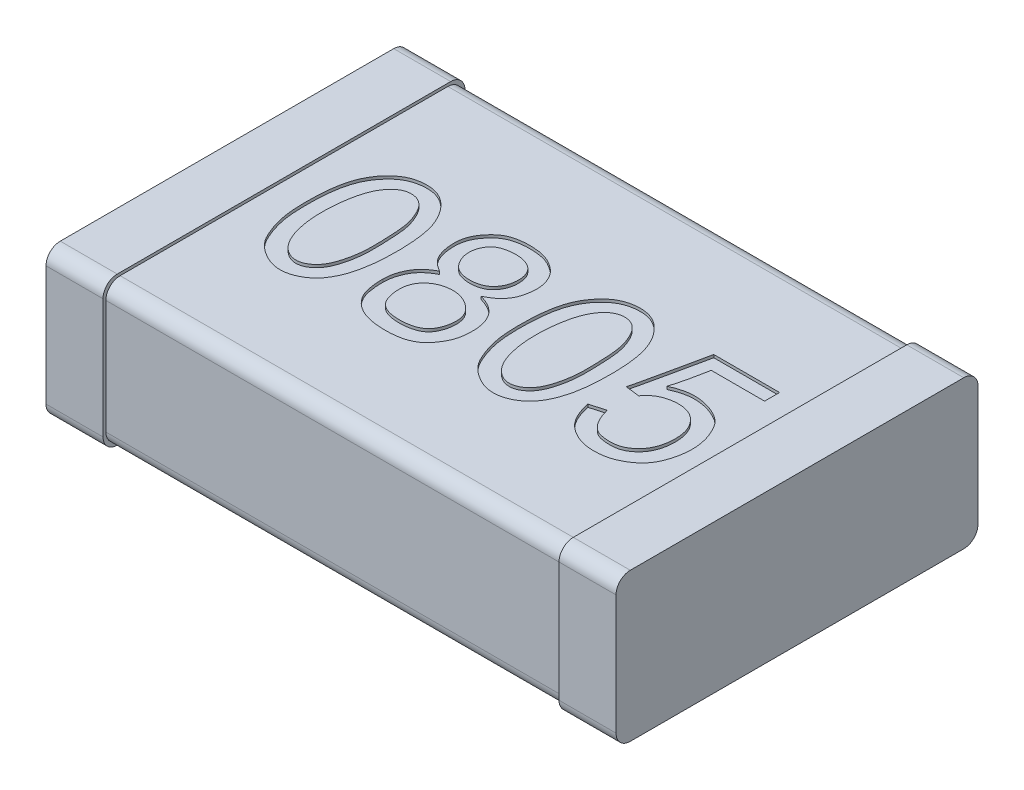
from build123d import *

# Parameters (mm, degrees)
SKETCH_1_W          = 2
SKETCH_1_H          = 1.25
EXTRUDE_1_DEPTH     = 0.5
SKETCH_2_W          = 1.27
SKETCH_2_H          = 0.52
EXTRUDE_2_DEPTH     = 0.2
SKETCH_3_W          = 1.27
SKETCH_3_H          = 0.52
EXTRUDE_3_DEPTH     = 0.2
CUT_EXTRUDE_1_DEPTH = 0.01
FILLET_1_R          = 0.05
FILLET_2_R          = 0.05


with BuildPart() as part:
    # 草图1 → 凸台-拉伸1 (new body)
    with BuildSketch(Plane(origin=(0, 0, 0), x_dir=(1, 0, 0), z_dir=(0, 1, 0))):
        Rectangle(SKETCH_1_W, SKETCH_1_H)
    extrude(amount=EXTRUDE_1_DEPTH)

    # 草图2 → 凸台-拉伸2 (add)
    with BuildSketch(Plane.ZY.offset(1)):
        with Locations((0, 0.25)):
            Rectangle(SKETCH_2_W, SKETCH_2_H)
    extrude(amount=-EXTRUDE_2_DEPTH)

    # 草图3 → 凸台-拉伸3 (add)
    with BuildSketch(Plane(origin=(1, 0, 0), x_dir=(0, 0, -1), z_dir=(1, 0, 0))):
        with Locations((0, 0.25)):
            Rectangle(SKETCH_3_W, SKETCH_3_H)
    extrude(amount=-EXTRUDE_3_DEPTH)

    # 草图4 → 切除-拉伸1 (cut)
    # profile 1 of 4: a face of its own
    with BuildSketch(Plane(origin=(0, 0.5, 0), x_dir=(1, 0, 0), z_dir=(0, 1, 0))):
        with BuildLine():
            add(Edge.make_bspline(
                [(-0.697551724, 0.012086435), (-0.697273285, 0.018370502), (-0.696730214, 0.030627027), (-0.695161169, 0.048498422), (-0.693266387, 0.065412192), (-0.69080292, 0.081316611), (-0.6877582, 0.09615874), (-0.68431195, 0.110016365), (-0.680329265, 0.122850712), (-0.674464846, 0.138525208), (-0.66567087, 0.156566364), (-0.653092049, 0.176394886), (-0.638475041, 0.194219333), (-0.624646887, 0.207279888), (-0.612656941, 0.216471968), (-0.603077204, 0.222440088), (-0.593012784, 0.227539397), (-0.582430676, 0.231697991), (-0.57135034, 0.234795743), (-0.559801131, 0.23708278), (-0.547744932, 0.238497576), (-0.535321613, 0.238918496), (-0.522804682, 0.238329132), (-0.510508589, 0.236409151), (-0.498643075, 0.233000694), (-0.487200036, 0.228321421), (-0.476210616, 0.222309135), (-0.465619495, 0.21501213), (-0.455552235, 0.206241697), (-0.445883363, 0.196353957), (-0.436852354, 0.185471712), (-0.428579969, 0.173804982), (-0.421100573, 0.161474107), (-0.41451386, 0.148411439), (-0.408609653, 0.134732164), (-0.403656549, 0.120314435), (-0.399558709, 0.105216828), (-0.395046346, 0.08388881), (-0.391076445, 0.055597746), (-0.388279599, 0.019792076), (-0.387641402, -0.018386797), (-0.388591689, -0.051403705), (-0.390383002, -0.078155018), (-0.392419526, -0.097558078), (-0.395154932, -0.115972347), (-0.398339269, -0.133487456), (-0.402323068, -0.15001026), (-0.407043913, -0.165558463), (-0.412144574, -0.180233637), (-0.418148327, -0.193881523), (-0.424687356, -0.206618025), (-0.432142408, -0.218279995), (-0.440218917, -0.229024955), (-0.44913098, -0.238767754), (-0.458994708, -0.247312134), (-0.469466928, -0.255070392), (-0.480828878, -0.261673544), (-0.492777795, -0.267276961), (-0.50508428, -0.271736567), (-0.517594692, -0.274643206), (-0.53007303, -0.276370796), (-0.542607227, -0.276377116), (-0.55512302, -0.275287325), (-0.56756901, -0.272420568), (-0.580098714, -0.268479087), (-0.59237652, -0.262905087), (-0.604193618, -0.256486906), (-0.615316658, -0.249579015), (-0.625441662, -0.242062239), (-0.63464953, -0.234034941), (-0.643055126, -0.22556452), (-0.650559253, -0.216570563), (-0.657084022, -0.207028167), (-0.664375332, -0.193598514), (-0.672186654, -0.176275889), (-0.680271328, -0.154938575), (-0.68687896, -0.133088019), (-0.691127802, -0.114310704), (-0.693929058, -0.098602045), (-0.695470314, -0.085724854), (-0.696809127, -0.071863065), (-0.697618267, -0.057013447), (-0.698156481, -0.041163126), (-0.698390721, -0.02430081), (-0.698140008, -0.006428462), (-0.697751281, 0.005805843), (-0.697551724, 0.012086435)],
                knots=[0, 0, 0, 0, 1.18043416, 2.302333746, 3.366253517, 4.374302266, 5.321670991, 6.208995316, 7.053297808, 7.84229274, 9.348259463, 10.810477328, 12.240076564, 13.663562249, 14.3695339, 15.072606272, 15.778577923, 16.484387009, 17.202829605, 17.934942377, 18.692112664, 19.478485278, 20.265441384, 21.040673806, 21.808439453, 22.577161074, 23.356320991, 24.155029842, 24.986154494, 25.858111265, 26.748121484, 27.637306138, 28.540117759, 29.452135788, 30.380885827, 31.334339875, 32.310628684, 33.31521083, 35.42407972, 37.666773946, 40.052062172, 42.587025658, 43.863776122, 45.083322308, 46.247467896, 47.357025429, 48.423487632, 49.435172604, 50.405897663, 51.337337341, 52.231284254, 53.090220275, 53.931690991, 54.751583713, 55.562922169, 56.377338113, 57.194202079, 58.024663732, 58.851830165, 59.645552351, 60.431282623, 61.21044254, 61.99312915, 62.783838437, 63.60230231, 64.454612977, 65.309477934, 66.125301685, 66.909862715, 67.67340185, 68.415973016, 69.147238889, 69.868837108, 70.581506411, 72.0124375, 73.431838244, 74.861437481, 76.292961888, 77.042577341, 77.855187732, 78.726196438, 79.655959089, 80.645695907, 81.702690171, 82.820655125, 84, 84, 84, 84], degree=3))
        make_face()
        with BuildLine():
            add(Edge.make_bspline(
                [(-0.636148216, 0.029630295), (-0.636812051, 0.023028505), (-0.638119831, 0.01002275), (-0.639189436, -0.009271034), (-0.639494245, -0.028018652), (-0.639215123, -0.046227686), (-0.638138697, -0.063862507), (-0.636302132, -0.080957243), (-0.633686, -0.097499894), (-0.630484086, -0.113446593), (-0.626647751, -0.12854246), (-0.622098166, -0.142582398), (-0.616919643, -0.155464127), (-0.61119098, -0.167207052), (-0.604902659, -0.177825192), (-0.597937584, -0.187258251), (-0.590491167, -0.195706903), (-0.582340871, -0.202806994), (-0.573981557, -0.208769539), (-0.565435089, -0.21340238), (-0.556840855, -0.216685213), (-0.548166053, -0.21869248), (-0.539441951, -0.219333388), (-0.530665069, -0.218712576), (-0.521900332, -0.216545779), (-0.513191274, -0.21322486), (-0.504787762, -0.208650908), (-0.496837745, -0.203127839), (-0.489506984, -0.196532112), (-0.482791604, -0.188934524), (-0.476730003, -0.180288081), (-0.471183747, -0.1707406), (-0.466313713, -0.160133725), (-0.460586972, -0.144603367), (-0.454819597, -0.123921092), (-0.44968852, -0.098076822), (-0.446662085, -0.071124618), (-0.445868586, -0.043471665), (-0.446384518, -0.015995037), (-0.447003315, 0.01062221), (-0.448491233, 0.035930332), (-0.450271976, 0.0600582), (-0.453294063, 0.083113537), (-0.458863368, 0.104975587), (-0.466664328, 0.12570363), (-0.474671168, 0.142066309), (-0.482344699, 0.153943772), (-0.488393923, 0.161913208), (-0.495119117, 0.168572627), (-0.502210444, 0.174249821), (-0.509832864, 0.178571987), (-0.517917445, 0.181805069), (-0.526460656, 0.183808636), (-0.535333027, 0.184796557), (-0.544271637, 0.184623855), (-0.55305151, 0.183054961), (-0.561567097, 0.180311184), (-0.569871981, 0.176405083), (-0.577791916, 0.171118283), (-0.5854535, 0.164647733), (-0.592770418, 0.156884475), (-0.599978053, 0.148039205), (-0.606552671, 0.13776812), (-0.612633031, 0.126262575), (-0.618025178, 0.113374741), (-0.622854403, 0.099179209), (-0.627191513, 0.083676749), (-0.63083815, 0.066858036), (-0.633864215, 0.048709664), (-0.635369528, 0.036135052), (-0.636148216, 0.029630295)],
                knots=[0, 0, 0, 0, 1.378198314, 2.715098627, 4.012594964, 5.272602849, 6.497213731, 7.681415101, 8.842769074, 9.975170128, 11.059162755, 12.076494648, 13.038717388, 13.940857576, 14.788360499, 15.598271168, 16.373595835, 17.122768248, 17.838466736, 18.502782022, 19.136468245, 19.744060339, 20.345653328, 20.947246317, 21.563841626, 22.214212994, 22.87852828, 23.546305104, 24.220743313, 24.921956094, 25.648106704, 26.41081768, 27.212668989, 28.069279432, 29.84713992, 31.666334073, 33.537864714, 35.473745168, 37.408579624, 39.246547954, 41.003985019, 42.674193204, 44.272363647, 45.827394737, 47.348405091, 48.867584295, 49.599750274, 50.283750763, 50.94125936, 51.560811542, 52.165388272, 52.754418158, 53.363720025, 53.982318455, 54.604903792, 55.213928724, 55.828148287, 56.458765578, 57.113918044, 57.800421407, 58.537638978, 59.326979919, 60.167286366, 61.066273245, 62.027297208, 63.065989643, 64.179487018, 65.369443928, 66.639232213, 68, 68, 68, 68], degree=3))
        make_face(mode=Mode.SUBTRACT)
    # profile 2 of 4: a face of its own
    with BuildSketch(Plane(origin=(0, 0.5, 0), x_dir=(1, 0, 0), z_dir=(0, 1, 0))):
        with BuildLine():
            add(Edge.make_bspline(
                [(0.050986287, 0.012086435), (0.051264726, 0.018370502), (0.051807798, 0.030627027), (0.053376843, 0.048498422), (0.055271625, 0.065412192), (0.057735091, 0.081316611), (0.060779812, 0.09615874), (0.064226062, 0.110016365), (0.068208746, 0.122850712), (0.074073165, 0.138525208), (0.082867142, 0.156566364), (0.095445963, 0.176394886), (0.11006297, 0.194219333), (0.123891125, 0.207279888), (0.13588107, 0.216471968), (0.145460808, 0.222440088), (0.155525228, 0.227539397), (0.166107336, 0.231697991), (0.177187672, 0.234795743), (0.188736881, 0.23708278), (0.20079308, 0.238497576), (0.213216399, 0.238918496), (0.22573333, 0.238329132), (0.238029422, 0.236409151), (0.249894937, 0.233000694), (0.261337975, 0.228321421), (0.272327396, 0.222309135), (0.282918517, 0.21501213), (0.292985777, 0.206241697), (0.302654649, 0.196353957), (0.311685658, 0.185471712), (0.319958043, 0.173804982), (0.327437439, 0.161474107), (0.334024152, 0.148411439), (0.339928358, 0.134732164), (0.344881463, 0.120314435), (0.348979302, 0.105216828), (0.353491665, 0.08388881), (0.357461567, 0.055597746), (0.360258412, 0.019792076), (0.36089661, -0.018386797), (0.359946323, -0.051403705), (0.35815501, -0.078155018), (0.356118486, -0.097558078), (0.35338308, -0.115972347), (0.350198742, -0.133487456), (0.346214943, -0.15001026), (0.341494099, -0.165558463), (0.336393438, -0.180233637), (0.330389685, -0.193881523), (0.323850656, -0.206618025), (0.316395603, -0.218279995), (0.308319095, -0.229024955), (0.299407032, -0.238767754), (0.289543303, -0.247312134), (0.279071084, -0.255070392), (0.267709133, -0.261673544), (0.255760217, -0.267276961), (0.243453732, -0.271736567), (0.230943319, -0.274643206), (0.218464981, -0.276370796), (0.205930785, -0.276377116), (0.193414992, -0.275287325), (0.180969002, -0.272420568), (0.168439298, -0.268479087), (0.156161492, -0.262905087), (0.144344393, -0.256486906), (0.133221353, -0.249579015), (0.123096349, -0.242062239), (0.113888482, -0.234034941), (0.105482885, -0.22556452), (0.097978758, -0.216570563), (0.09145399, -0.207028167), (0.08416268, -0.193598514), (0.076351358, -0.176275889), (0.068266684, -0.154938575), (0.061659051, -0.133088019), (0.057410209, -0.114310704), (0.054608954, -0.098602045), (0.053067698, -0.085724854), (0.051728885, -0.071863065), (0.050919745, -0.057013447), (0.050381531, -0.041163126), (0.050147291, -0.02430081), (0.050398004, -0.006428462), (0.050786731, 0.005805843), (0.050986287, 0.012086435)],
                knots=[0, 0, 0, 0, 1.18043416, 2.302333746, 3.366253517, 4.374302266, 5.321670991, 6.208995316, 7.053297808, 7.84229274, 9.348259463, 10.810477328, 12.240076564, 13.663562249, 14.3695339, 15.072606272, 15.778577923, 16.484387009, 17.202829605, 17.934942377, 18.692112664, 19.478485278, 20.265441384, 21.040673806, 21.808439453, 22.577161074, 23.356320991, 24.155029842, 24.986154494, 25.858111265, 26.748121484, 27.637306138, 28.540117759, 29.452135788, 30.380885827, 31.334339875, 32.310628684, 33.31521083, 35.42407972, 37.666773946, 40.052062172, 42.587025658, 43.863776122, 45.083322308, 46.247467896, 47.357025429, 48.423487632, 49.435172604, 50.405897663, 51.337337341, 52.231284254, 53.090220275, 53.931690991, 54.751583713, 55.562922169, 56.377338113, 57.194202079, 58.024663732, 58.851830165, 59.645552351, 60.431282623, 61.21044254, 61.99312915, 62.783838437, 63.60230231, 64.454612977, 65.309477934, 66.125301685, 66.909862715, 67.67340185, 68.415973016, 69.147238889, 69.868837108, 70.581506411, 72.0124375, 73.431838244, 74.861437481, 76.292961888, 77.042577341, 77.855187732, 78.726196438, 79.655959089, 80.645695907, 81.702690171, 82.820655125, 84, 84, 84, 84], degree=3))
        make_face()
        with BuildLine():
            add(Edge.make_bspline(
                [(0.112389796, 0.029630295), (0.11172596, 0.023028505), (0.110418181, 0.01002275), (0.109348575, -0.009271034), (0.109043767, -0.028018652), (0.109322888, -0.046227686), (0.110399315, -0.063862507), (0.112235879, -0.080957243), (0.114852011, -0.097499894), (0.118053926, -0.113446593), (0.121890261, -0.12854246), (0.126439846, -0.142582398), (0.131618369, -0.155464127), (0.137347032, -0.167207052), (0.143635353, -0.177825192), (0.150600428, -0.187258251), (0.158046844, -0.195706903), (0.166197141, -0.202806994), (0.174556455, -0.208769539), (0.183102923, -0.21340238), (0.191697156, -0.216685213), (0.200371958, -0.21869248), (0.209096061, -0.219333388), (0.217872942, -0.218712576), (0.22663768, -0.216545779), (0.235346738, -0.21322486), (0.24375025, -0.208650908), (0.251700267, -0.203127839), (0.259031027, -0.196532112), (0.265746408, -0.188934524), (0.271808009, -0.180288081), (0.277354265, -0.1707406), (0.282224299, -0.160133725), (0.28795104, -0.144603367), (0.293718415, -0.123921092), (0.298849492, -0.098076822), (0.301875927, -0.071124618), (0.302669426, -0.043471665), (0.302153493, -0.015995037), (0.301534697, 0.01062221), (0.300046779, 0.035930332), (0.298266036, 0.0600582), (0.295243948, 0.083113537), (0.289674644, 0.104975587), (0.281873684, 0.12570363), (0.273866843, 0.142066309), (0.266193313, 0.153943772), (0.260144089, 0.161913208), (0.253418895, 0.168572627), (0.246327568, 0.174249821), (0.238705147, 0.178571987), (0.230620567, 0.181805069), (0.222077356, 0.183808636), (0.213204984, 0.184796557), (0.204266374, 0.184623855), (0.195486502, 0.183054961), (0.186970915, 0.180311184), (0.178666031, 0.176405083), (0.170746095, 0.171118283), (0.163084512, 0.164647733), (0.155767594, 0.156884475), (0.148559958, 0.148039205), (0.141985341, 0.13776812), (0.135904981, 0.126262575), (0.130512834, 0.113374741), (0.125683608, 0.099179209), (0.121346498, 0.083676749), (0.117699861, 0.066858036), (0.114673797, 0.048709664), (0.113168484, 0.036135052), (0.112389796, 0.029630295)],
                knots=[0, 0, 0, 0, 1.378198314, 2.715098627, 4.012594964, 5.272602849, 6.497213731, 7.681415101, 8.842769074, 9.975170128, 11.059162755, 12.076494648, 13.038717388, 13.940857576, 14.788360499, 15.598271168, 16.373595835, 17.122768248, 17.838466736, 18.502782022, 19.136468245, 19.744060339, 20.345653328, 20.947246317, 21.563841626, 22.214212994, 22.87852828, 23.546305104, 24.220743313, 24.921956094, 25.648106704, 26.41081768, 27.212668989, 28.069279432, 29.84713992, 31.666334073, 33.537864714, 35.473745168, 37.408579624, 39.246547954, 41.003985019, 42.674193204, 44.272363647, 45.827394737, 47.348405091, 48.867584295, 49.599750274, 50.283750763, 50.94125936, 51.560811542, 52.165388272, 52.754418158, 53.363720025, 53.982318455, 54.604903792, 55.213928724, 55.828148287, 56.458765578, 57.113918044, 57.800421407, 58.537638978, 59.326979919, 60.167286366, 61.066273245, 62.027297208, 63.065989643, 64.179487018, 65.369443928, 66.639232213, 68, 68, 68, 68], degree=3))
        make_face(mode=Mode.SUBTRACT)
    # profile 3 of 4: a face of its own
    with BuildSketch(Plane(origin=(0, 0.5, 0), x_dir=(1, 0, 0), z_dir=(0, 1, 0))):
        with BuildLine():
            add(Edge.make_bspline(
                [(-0.329130672, -0.12382433), (-0.328931482, -0.117995656), (-0.328531045, -0.106278138), (-0.324968812, -0.088914485), (-0.319538837, -0.071705837), (-0.313166973, -0.057743429), (-0.306951757, -0.046834868), (-0.301385036, -0.039045732), (-0.295157036, -0.031625586), (-0.28826451, -0.024565917), (-0.280468315, -0.018067819), (-0.272043745, -0.011914446), (-0.262914204, -0.006112397), (-0.256419314, -0.002738045), (-0.25310728, -0.001017312)],
                knots=[0, 0, 0, 0, 1.374126598, 2.76243824, 4.166032791, 5.626085304, 6.374165685, 7.125778304, 7.881627021, 8.658683375, 9.450540369, 10.273494042, 11.119577685, 12, 12, 12, 12], degree=3))
            add(Edge.make_bspline(
                [(-0.25310728, -0.001017312), (-0.258535298, 0.002359841), (-0.268841252, 0.008771902), (-0.282200292, 0.019817785), (-0.292644159, 0.031517343), (-0.300220107, 0.043986021), (-0.305363827, 0.057228054), (-0.309247195, 0.071134882), (-0.311962746, 0.085921671), (-0.313317183, 0.101253803), (-0.313386395, 0.116521943), (-0.311891178, 0.131045176), (-0.308996628, 0.144506099), (-0.304600775, 0.156939622), (-0.298732172, 0.168600589), (-0.291494964, 0.179690531), (-0.283286707, 0.190651211), (-0.273721789, 0.200855057), (-0.263400916, 0.210250348), (-0.252307007, 0.218132544), (-0.240606233, 0.224276373), (-0.228281803, 0.228694682), (-0.215490612, 0.231891261), (-0.202163265, 0.234154709), (-0.188343538, 0.235584112), (-0.174160205, 0.235931559), (-0.160098484, 0.235646265), (-0.146533561, 0.23458336), (-0.133728703, 0.232742563), (-0.121408574, 0.230168346), (-0.109284117, 0.226281048), (-0.096911018, 0.220975575), (-0.08442865, 0.21361616), (-0.071493095, 0.2052439), (-0.059217547, 0.194882496), (-0.048705165, 0.182168325), (-0.039983054, 0.167506088), (-0.034444546, 0.153815276), (-0.031205053, 0.142012607), (-0.029296046, 0.132688873), (-0.028384207, 0.122967072), (-0.028119144, 0.112899061), (-0.02888187, 0.102451582), (-0.030098505, 0.091617536), (-0.032350133, 0.080458891), (-0.035200514, 0.069066106), (-0.038945325, 0.057695361), (-0.044339803, 0.046920568), (-0.051026239, 0.036774814), (-0.058927178, 0.027203809), (-0.068293222, 0.018377669), (-0.078897161, 0.01014844), (-0.090918841, 0.002659206), (-0.099544196, -0.00169815), (-0.103984473, -0.003941289)],
                knots=[0, 0, 0, 0, 1.410033332, 2.677172402, 3.812064432, 4.856127883, 5.878591605, 6.938109193, 8.03995885, 9.192064022, 10.3315345, 11.405101817, 12.408541443, 13.363710648, 14.308049618, 15.282826904, 16.283668828, 17.326789228, 18.365059226, 19.359919842, 20.322241493, 21.272612498, 22.242786748, 23.229219042, 24.254411489, 25.306713209, 26.358803724, 27.358026599, 28.307996659, 29.212919167, 30.132734509, 31.114165642, 32.177631088, 33.326839266, 34.513504529, 35.70718515, 36.950754538, 38.266204093, 38.952498493, 39.651034787, 40.363832527, 41.105058096, 41.871509902, 42.674059092, 43.510125888, 44.381738271, 45.266222349, 46.146424753, 47.03266586, 47.943741995, 48.879333301, 49.867534116, 50.90222043, 52, 52, 52, 52], degree=3))
            add(Edge.make_bspline(
                [(-0.103984473, -0.003941289), (-0.099957216, -0.005181838), (-0.092136006, -0.00759107), (-0.081084035, -0.012070494), (-0.070913001, -0.016976811), (-0.061592159, -0.0222858), (-0.053322731, -0.028374307), (-0.0457817, -0.034697274), (-0.039222902, -0.041667128), (-0.031902374, -0.051724365), (-0.024291707, -0.06536172), (-0.017855023, -0.083400982), (-0.014146417, -0.103086485), (-0.012979321, -0.123712491), (-0.013930879, -0.14395634), (-0.016083676, -0.162727291), (-0.020307249, -0.179313232), (-0.026119419, -0.193782215), (-0.033073999, -0.206433372), (-0.040126268, -0.218014742), (-0.04764199, -0.228488693), (-0.055607473, -0.237976067), (-0.064490643, -0.246527164), (-0.074841646, -0.253925133), (-0.08663482, -0.260408988), (-0.09987599, -0.266070104), (-0.114826681, -0.270553784), (-0.131538984, -0.273558502), (-0.150069659, -0.275513411), (-0.169864507, -0.276061808), (-0.189837068, -0.275496582), (-0.208869675, -0.273540136), (-0.226497666, -0.27047944), (-0.242710298, -0.266037256), (-0.257599265, -0.260371818), (-0.270967233, -0.253031712), (-0.283376449, -0.244926941), (-0.294185936, -0.235177058), (-0.303638591, -0.224483035), (-0.311538589, -0.212828721), (-0.31763492, -0.200180175), (-0.322212122, -0.186637596), (-0.325191834, -0.172132735), (-0.327472429, -0.156840273), (-0.328928611, -0.140638033), (-0.329062091, -0.129531014), (-0.329130672, -0.12382433)],
                knots=[0, 0, 0, 0, 0.834664037, 1.620974963, 2.359958192, 3.071500661, 3.742523023, 4.391885647, 5.019370884, 5.633088925, 6.853041206, 8.099687998, 9.411290177, 10.808708308, 12.183221387, 13.42351142, 14.545940998, 15.563362997, 16.504155904, 17.403380615, 18.249005911, 19.055869055, 19.855247075, 20.685085447, 21.568786071, 22.517377533, 23.533390568, 24.654269325, 25.877028168, 27.222423441, 28.574967808, 29.833297063, 31.01045681, 32.11582339, 33.159850443, 34.158288642, 35.132345709, 36.089875077, 37.032569401, 37.955047952, 38.86995275, 39.806385064, 40.780048122, 41.799705361, 42.869508764, 44, 44, 44, 44], degree=3))
        make_face()
        with BuildLine():
            add(Edge.make_bspline(
                [(-0.269243299, -0.120900353), (-0.269310398, -0.126573594), (-0.26944084, -0.137602475), (-0.267325421, -0.153609794), (-0.263516985, -0.168529116), (-0.258929231, -0.180170244), (-0.254000926, -0.18863878), (-0.249662828, -0.194402715), (-0.244640188, -0.199584444), (-0.238832516, -0.203965623), (-0.232463584, -0.20797844), (-0.225351285, -0.211262274), (-0.217549206, -0.213992014), (-0.206283051, -0.216843721), (-0.191462208, -0.218874701), (-0.173270276, -0.219608488), (-0.15473761, -0.218051672), (-0.139229115, -0.215460154), (-0.127141636, -0.212036045), (-0.118648992, -0.208832199), (-0.110903079, -0.204803607), (-0.103898864, -0.200023775), (-0.097714313, -0.194421293), (-0.092116687, -0.188235994), (-0.087316176, -0.181239816), (-0.082126549, -0.171012263), (-0.077042723, -0.157776146), (-0.073316435, -0.141509139), (-0.0718195, -0.125283435), (-0.072754274, -0.111820144), (-0.07468627, -0.101295492), (-0.07706821, -0.093686733), (-0.080393143, -0.086443291), (-0.084515355, -0.079499083), (-0.089532345, -0.072823136), (-0.095537711, -0.06659783), (-0.102283982, -0.060588914), (-0.112320484, -0.053177404), (-0.125869467, -0.045406984), (-0.143238704, -0.038772782), (-0.161470242, -0.035697567), (-0.17996318, -0.03564262), (-0.19797783, -0.038274829), (-0.214801667, -0.043542756), (-0.229883744, -0.051648985), (-0.24105527, -0.060287285), (-0.248823842, -0.068331406), (-0.253919479, -0.074783415), (-0.258461778, -0.081475761), (-0.261980277, -0.088707019), (-0.264939433, -0.096231428), (-0.267249623, -0.104117377), (-0.268622829, -0.112411677), (-0.26903454, -0.118044318), (-0.269243299, -0.120900353)],
                knots=[0, 0, 0, 0, 1.45021583, 2.819245253, 4.116311686, 5.383839525, 6.004804309, 6.61809702, 7.225519428, 7.844420058, 8.474928218, 9.148418113, 9.843660174, 10.58739695, 12.118283095, 13.661739419, 15.236493707, 16.868915606, 17.675810439, 18.447690583, 19.187171155, 19.904516724, 20.610957382, 21.317398041, 22.03474361, 22.774224182, 24.247695365, 25.650274601, 27.031710525, 28.40179887, 29.088335786, 29.76605575, 30.435671148, 31.123139383, 31.828794671, 32.567062931, 33.332561727, 34.137975047, 35.755592712, 37.313353339, 38.869799076, 40.458468512, 42.027252455, 43.511108451, 44.944907386, 46.386035674, 47.104569492, 47.801282449, 48.487819365, 49.169367754, 49.853726664, 50.555320331, 51.267473945, 52, 52, 52, 52], degree=3))
        make_face(mode=Mode.SUBTRACT)
        with BuildLine():
            add(Edge.make_bspline(
                [(-0.258955233, 0.107169822), (-0.258695853, 0.102344547), (-0.258174977, 0.092654653), (-0.254181462, 0.078350025), (-0.247677072, 0.064478105), (-0.240298127, 0.053493478), (-0.233137553, 0.045335363), (-0.226852794, 0.03997003), (-0.219891244, 0.035371267), (-0.212100547, 0.03170892), (-0.203648163, 0.028779522), (-0.194457447, 0.026718961), (-0.184550763, 0.025594006), (-0.17415987, 0.025144879), (-0.16373338, 0.025598798), (-0.153755596, 0.026720361), (-0.144455037, 0.028775738), (-0.135872099, 0.031733582), (-0.127890373, 0.035362736), (-0.120703489, 0.039996803), (-0.114114259, 0.045325224), (-0.10831919, 0.051495368), (-0.103267502, 0.058240417), (-0.098787209, 0.065270971), (-0.095058356, 0.072700365), (-0.092195554, 0.080452921), (-0.08995047, 0.088485774), (-0.088607385, 0.096841562), (-0.087816262, 0.105527247), (-0.087830169, 0.114406614), (-0.088579897, 0.123133182), (-0.089953274, 0.131448521), (-0.09209704, 0.139162879), (-0.095058463, 0.146280598), (-0.098719784, 0.152828714), (-0.103244979, 0.158690443), (-0.108326631, 0.164085396), (-0.114266761, 0.168707059), (-0.120715196, 0.172862678), (-0.127861587, 0.176174037), (-0.135447664, 0.179028211), (-0.143614047, 0.181174843), (-0.152309129, 0.182682764), (-0.161578437, 0.183534068), (-0.171384709, 0.183737384), (-0.181505163, 0.183267242), (-0.191499074, 0.182377003), (-0.200958545, 0.180771796), (-0.209641556, 0.178484182), (-0.217566809, 0.175714342), (-0.224723635, 0.172310546), (-0.231145719, 0.16835356), (-0.236716125, 0.163634393), (-0.242993918, 0.156707075), (-0.249441677, 0.147185927), (-0.254842307, 0.134636576), (-0.258414415, 0.121227609), (-0.258772407, 0.111922117), (-0.258955233, 0.107169822)],
                knots=[0, 0, 0, 0, 1.534693845, 3.081901317, 4.691243309, 6.396534232, 7.275531407, 8.139372323, 9.019120457, 9.923811509, 10.872401943, 11.862147786, 12.91556615, 14.042756034, 15.169945918, 16.234774491, 17.235732746, 18.195190674, 19.120665344, 20.019718268, 20.909987491, 21.812339702, 22.706457796, 23.589652117, 24.463374508, 25.347092071, 26.216951264, 27.114386788, 28.037289102, 28.991155695, 29.936957382, 30.823062971, 31.670776101, 32.479662527, 33.27221946, 34.051415611, 34.83171274, 35.625019215, 36.441220146, 37.268830285, 38.126995544, 39.019043232, 39.952404705, 40.933573035, 41.979631126, 43.072373492, 44.157596343, 45.172184403, 46.122722093, 47.013287973, 47.840898113, 48.641248973, 49.407885578, 50.156214404, 51.612891957, 53.043495678, 54.490119686, 56, 56, 56, 56], degree=3))
        make_face(mode=Mode.SUBTRACT)
    # profile 4 of 4: a face of its own
    with BuildSketch(Plane(origin=(0, 0.5, 0), x_dir=(1, 0, 0), z_dir=(0, 1, 0))):
        with BuildLine():
            add(Edge.make_bspline(
                [(0.463266989, -0.129672283), (0.464994653, -0.13591739), (0.468296014, -0.147851044), (0.474813037, -0.164401268), (0.48222415, -0.178789478), (0.4905947, -0.190985792), (0.499852047, -0.201020341), (0.51007159, -0.20888784), (0.52129408, -0.214594966), (0.533344042, -0.217607007), (0.545349859, -0.219218923), (0.55692555, -0.220084588), (0.567898262, -0.220293246), (0.578262795, -0.219393515), (0.588062364, -0.217693369), (0.597256934, -0.215065323), (0.605937659, -0.211777302), (0.61635755, -0.205893294), (0.628148322, -0.197428626), (0.64034578, -0.185605052), (0.650390316, -0.172338932), (0.658025846, -0.157552217), (0.663796362, -0.141672585), (0.667497261, -0.124768071), (0.669614884, -0.10702754), (0.669640458, -0.088766999), (0.667990507, -0.070743482), (0.663958326, -0.053750387), (0.657818224, -0.038154294), (0.649297283, -0.02433426), (0.639218609, -0.012227489), (0.627725353, -0.002130169), (0.614756939, 0.005538788), (0.600699571, 0.011146105), (0.585464168, 0.01427888), (0.56932134, 0.015574038), (0.552281, 0.01411697), (0.537673541, 0.011636204), (0.525967411, 0.008195067), (0.517383132, 0.004984868), (0.509226022, 0.000950598), (0.501498167, -0.003831324), (0.494243948, -0.009384394), (0.48737244, -0.01562174), (0.480829721, -0.022530577), (0.476938163, -0.027655687), (0.474962895, -0.030257078)],
                knots=[0, 0, 0, 0, 1.403509506, 2.681938941, 3.847186812, 4.904053079, 5.878231469, 6.793588087, 7.685750207, 8.585290775, 9.470393314, 10.30982016, 11.100009672, 11.845851359, 12.560986003, 13.25196324, 13.915882336, 14.567096566, 15.839407414, 17.051005178, 18.23545006, 19.428749574, 20.64387823, 21.887016089, 23.170843897, 24.508646813, 25.837452598, 27.084130207, 28.281193557, 29.453850041, 30.586740233, 31.684789218, 32.751426146, 33.836635946, 34.949110065, 36.110148403, 37.333609581, 38.6456127, 39.314033617, 39.97513508, 40.629396656, 41.282862607, 41.941599093, 42.606255263, 43.292566534, 44, 44, 44, 44], degree=3))
            Line((0.474962895, -0.030257078), (0.425255293, -0.024409125))
            add(Edge.make_bspline(
                [(0.425255293, -0.024409125), (0.42554496, -0.023398655), (0.426288291, -0.020805635), (0.427603327, -0.016098216), (0.429046608, -0.009636176), (0.431035367, -0.001568512), (0.433307368, 0.008215241), (0.435866534, 0.019711751), (0.438977439, 0.032890008), (0.44210491, 0.047805656), (0.445893551, 0.064343271), (0.449841711, 0.082586063), (0.4541977, 0.102543247), (0.458842749, 0.124168813), (0.463797018, 0.147502028), (0.469288812, 0.172486359), (0.474826152, 0.199234651), (0.478776713, 0.217597747), (0.480810849, 0.227052863)],
                knots=[0, 0, 0, 0, 0.195918666, 0.502756957, 0.910723646, 1.429643005, 2.051416563, 2.782622329, 3.624763054, 4.57489522, 5.622803535, 6.786745287, 8.053588175, 9.429911375, 10.909141366, 12.499269938, 14.197481979, 16, 16, 16, 16], degree=3))
            Line((0.480810849, 0.227052863), (0.711805001, 0.227052863))
            Line((0.711805001, 0.227052863), (0.711805001, 0.174421284))
            Line((0.711805001, 0.174421284), (0.524670498, 0.174421284))
            add(Edge.make_bspline(
                [(0.524670498, 0.174421284), (0.523445379, 0.167995395), (0.521062799, 0.155498483), (0.517544032, 0.137242042), (0.513821297, 0.120037487), (0.510187109, 0.103816622), (0.506444734, 0.088641503), (0.502944877, 0.0744157), (0.499249157, 0.061212563), (0.496673199, 0.052764881), (0.495430732, 0.04869029)],
                knots=[0, 0, 0, 0, 1.215572633, 2.36401571, 3.454665764, 4.486357605, 5.452744809, 6.358917092, 7.208452572, 8, 8, 8, 8], degree=3))
            add(Edge.make_bspline(
                [(0.495430732, 0.04869029), (0.50255047, 0.051820215), (0.516317831, 0.057872515), (0.537329368, 0.063888615), (0.557561417, 0.067431832), (0.577157763, 0.068032258), (0.596127249, 0.066320804), (0.614667493, 0.062854862), (0.632832315, 0.057493044), (0.650358843, 0.050481833), (0.666611776, 0.041906322), (0.680801603, 0.031669822), (0.692634959, 0.019871673), (0.701729401, 0.006489599), (0.708988607, -0.007457711), (0.715679246, -0.021258087), (0.720740869, -0.035291942), (0.725117884, -0.049273463), (0.728238856, -0.063549218), (0.73034755, -0.078277338), (0.731153471, -0.093564862), (0.730908458, -0.109334751), (0.729701243, -0.125500378), (0.726884855, -0.141874551), (0.722986859, -0.158487201), (0.717929355, -0.175060442), (0.711428476, -0.191009836), (0.70339345, -0.205770521), (0.693830806, -0.219057785), (0.68275839, -0.230872551), (0.670277945, -0.241290537), (0.656582578, -0.250611564), (0.64161842, -0.258886484), (0.62544349, -0.266063027), (0.607898062, -0.271644062), (0.589067097, -0.275207791), (0.568953519, -0.276607076), (0.551483527, -0.276349991), (0.537138745, -0.274822843), (0.526362756, -0.272834908), (0.515679005, -0.270185333), (0.505191783, -0.26641809), (0.494795779, -0.262004881), (0.484545323, -0.256772593), (0.474468909, -0.250666449), (0.464523697, -0.243822428), (0.454951461, -0.235882144), (0.446225834, -0.226547123), (0.438258718, -0.215933098), (0.431155413, -0.204070129), (0.424672824, -0.190997586), (0.419302654, -0.176532239), (0.414299798, -0.160924118), (0.411881379, -0.14994738), (0.41063541, -0.144292166)],
                knots=[0, 0, 0, 0, 1.450390688, 2.804604791, 4.068648926, 5.275556911, 6.452442725, 7.618143571, 8.790951587, 9.982238022, 11.136940521, 12.212542103, 13.237026736, 14.239013163, 15.218911754, 16.171529131, 17.09905193, 18.000756875, 18.904901006, 19.823593684, 20.775281061, 21.75922621, 22.766546237, 23.797944411, 24.85712428, 25.950563056, 27.029284285, 28.066718635, 29.080397459, 30.07683947, 31.08115718, 32.109159614, 33.164904064, 34.269231731, 35.407297279, 36.594115443, 37.837623493, 39.165424584, 39.850059771, 40.528130199, 41.209674166, 41.902321297, 42.605767297, 43.317013374, 44.048560119, 44.803777729, 45.569089644, 46.365200101, 47.183281588, 48.041959287, 48.943059703, 49.90294273, 50.919596225, 52, 52, 52, 52], degree=3))
            Line((0.41063541, -0.144292166), (0.463266989, -0.129672283))
        make_face()
    extrude(amount=-CUT_EXTRUDE_1_DEPTH, mode=Mode.SUBTRACT)

    # 圆角1
    fillet_1_edges = [part.edges().sort_by_distance(p)[0] for p in [
        (0, 0, 0.625),
        (0, 0.5, 0.625),
        (0, 0, -0.625),
        (0, 0.5, -0.625),
    ]]
    fillet(fillet_1_edges, radius=FILLET_1_R)

    # 圆角2
    fillet_2_edges = [part.edges().sort_by_distance(p)[0] for p in [
        (-0.9, -0.01, -0.635),
        (-0.9, 0.51, -0.635),
        (-0.9, 0.51, 0.635),
        (-0.9, -0.01, 0.635),
        (0.9, -0.01, 0.635),
        (0.9, 0.51, 0.635),
        (0.9, 0.51, -0.635),
        (0.9, -0.01, -0.635),
    ]]
    fillet(fillet_2_edges, radius=FILLET_2_R)


solid = part.part
